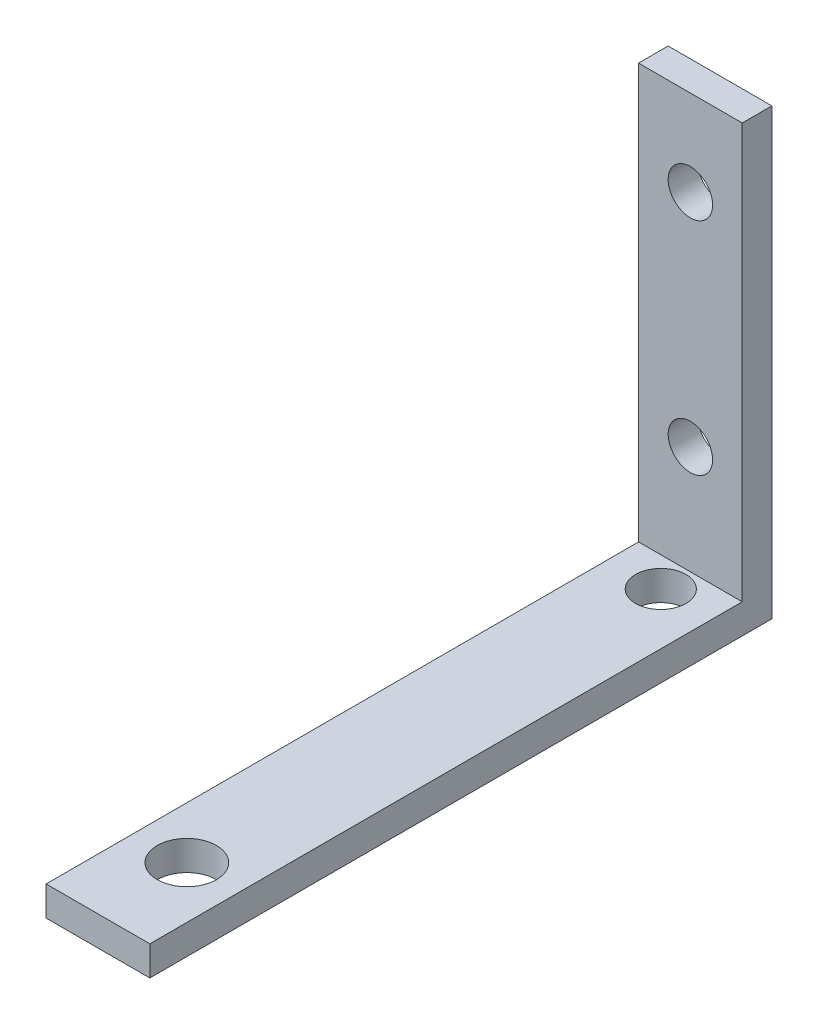
from build123d import *

# Parameters (mm, degrees)
ESBO_O2_W                = 7
ESBO_O2_H                = 30
RESSALTO_EXTRUS_O1_DEPTH = 2
ESBO_O3_W                = 7
ESBO_O3_H                = 2
RESSALTO_EXTRUS_O2_DEPTH = 40
CORTE_EXTRUS_O1_REACH    = 53.732
ESBO_O4_R                = 1.7
ESBO_O4_R_2              = 2
ESBO_O5_R                = 1.5
CORTE_EXTRUS_O2_DEPTH    = 10


with BuildPart() as part:
    # Esboço2 → Ressalto-extrusão1 (new body)
    with BuildSketch(Plane.XY):
        Rectangle(ESBO_O2_W, ESBO_O2_H)
    extrude(amount=RESSALTO_EXTRUS_O1_DEPTH)

    # Esboço3 → Ressalto-extrusão2 (add)
    with BuildSketch(Plane.XY.offset(2)):
        with Locations((0, -14)):
            Rectangle(ESBO_O3_W, ESBO_O3_H)
    extrude(amount=RESSALTO_EXTRUS_O2_DEPTH)

    # Esboço4 → Corte-extrusão1 (cut, up to next)
    with BuildSketch(Plane.XZ.offset(15), mode=Mode.PRIVATE) as corte_extrus_o1_sk1:
        with Locations(Location((0, 4, 0), (0, 0, 270))):
            Circle(ESBO_O4_R)
    corte_extrus_o1_tool1 = extrude(corte_extrus_o1_sk1.sketch, amount=-CORTE_EXTRUS_O1_REACH, mode=Mode.PRIVATE) & part.part
    # Esboço4 → Corte-extrusão1 (cut, up to next)
    with BuildSketch(Plane.XZ.offset(15), mode=Mode.PRIVATE) as corte_extrus_o1_sk2:
        with Locations(Location((0, 36, 0), (0, 0, 270))):
            Circle(ESBO_O4_R_2)
    corte_extrus_o1_tool2 = extrude(corte_extrus_o1_sk2.sketch, amount=-CORTE_EXTRUS_O1_REACH, mode=Mode.PRIVATE) & part.part
    add(corte_extrus_o1_tool1.solids().sort_by_distance((0, -15, 4))[0], mode=Mode.SUBTRACT)
    add(corte_extrus_o1_tool2.solids().sort_by_distance((0, -15, 36))[0], mode=Mode.SUBTRACT)

    # Esboço5 → Corte-extrusão2 (cut)
    with BuildSketch(Plane.XY.offset(2)):
        with Locations((0, -5.695873952)):
            Circle(ESBO_O5_R)
        with Locations((0, 9.199228267)):
            Circle(ESBO_O5_R)
    extrude(amount=-CORTE_EXTRUS_O2_DEPTH, mode=Mode.SUBTRACT)


solid = part.part
